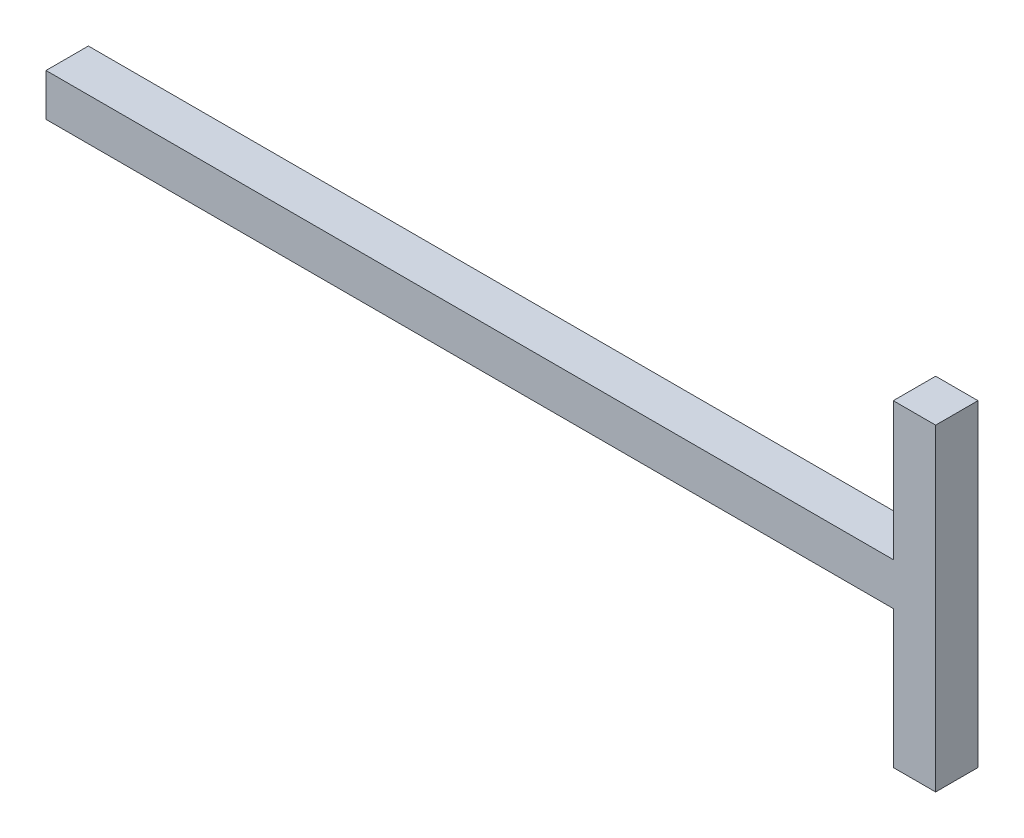
from build123d import *

# Parameters (mm, degrees)
SKETCH1_W           = 20
SKETCH1_H           = 20
BOSS_EXTRUDE1_DEPTH = 150
SKETCH2_W           = 20
SKETCH2_H           = 20
BOSS_EXTRUDE2_DEPTH = 400


with BuildPart() as part:
    # Sketch1 → Boss-Extrude1 (new body)
    with BuildSketch(Plane(origin=(0, 0, 0), x_dir=(1, 0, 0), z_dir=(0, 1, 0))):
        Rectangle(SKETCH1_W, SKETCH1_H)
    extrude(amount=BOSS_EXTRUDE1_DEPTH)

    # Sketch2 → Boss-Extrude2 (add)
    with BuildSketch(Plane.ZY.offset(10)):
        with Locations((0, 75)):
            Rectangle(SKETCH2_W, SKETCH2_H)
    extrude(amount=BOSS_EXTRUDE2_DEPTH)


solid = part.part
